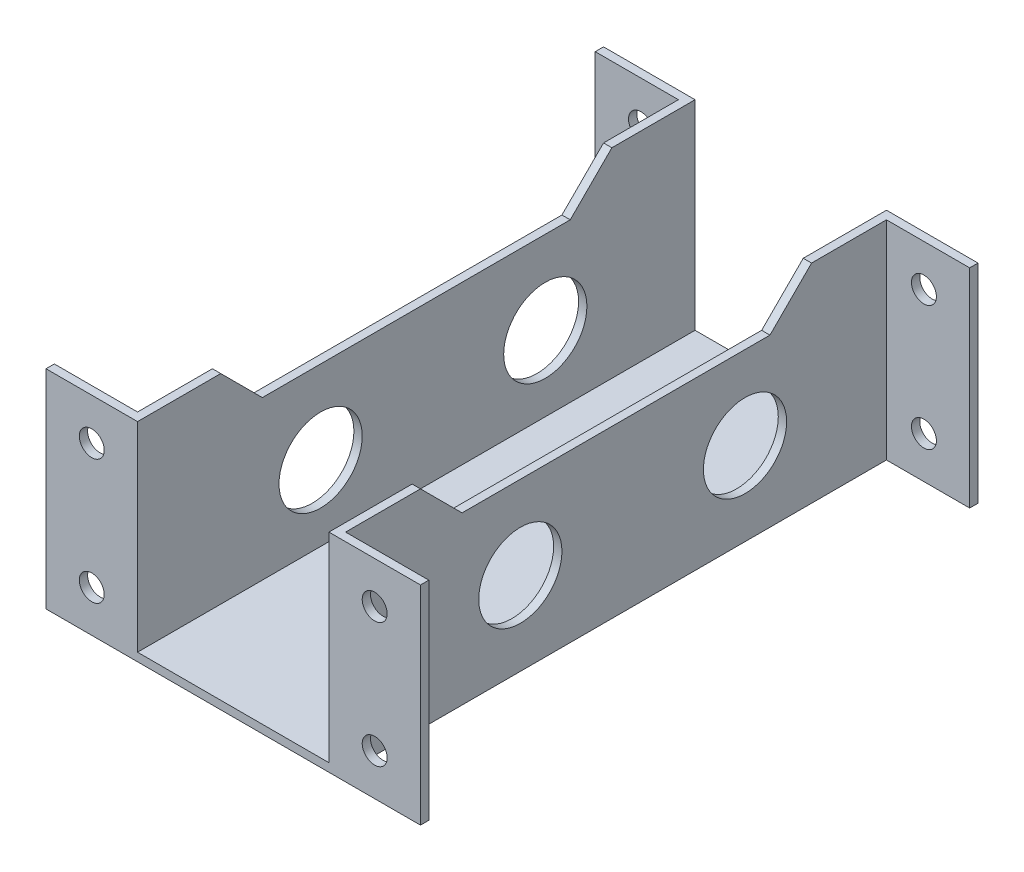
from build123d import *

# Parameters (mm, degrees)
SKETCH1_W               = 25
SKETCH1_H               = 67
BOSS_EXTRUDE1_DEPTH     = 1
SKETCH2_W               = 1
SKETCH2_H               = 67
BOSS_EXTRUDE2_DEPTH     = 24
SKETCH3_W               = 1
SKETCH3_H               = 25
BOSS_EXTRUDE3_DEPTH     = 10
SKETCH4_W               = 1
SKETCH4_H               = 25
BOSS_EXTRUDE4_DEPTH     = 10
SKETCH5_R               = 5
CUT_EXTRUDE1_DEPTH      = 47.952103254
SKETCH10_R              = 1.5
CUT_EXTRUDE3_DEPTH      = 75.968326645
CUT_EXTRUDE4_DEPTH      = 55.518345536
CUT_EXTRUDE4_DEPTH_BACK = 55.518345536
SKETCH9_R               = 5
CUT_EXTRUDE2_DEPTH      = 55.518345536


with BuildPart() as part:
    # Sketch1 → Boss-Extrude1 (new body)
    with BuildSketch(Plane(origin=(0, 0, 0), x_dir=(1, 0, 0), z_dir=(0, 1, 0))):
        Rectangle(SKETCH1_W, SKETCH1_H)
    extrude(amount=BOSS_EXTRUDE1_DEPTH)

    # Sketch2 → Boss-Extrude2 (add)
    with BuildSketch(Plane(origin=(0, 1, 0), x_dir=(1, 0, 0), z_dir=(0, 1, 0))):
        with Locations((12, 0)):
            Rectangle(SKETCH2_W, SKETCH2_H)
        with Locations((-12, 0)):
            Rectangle(SKETCH2_W, SKETCH2_H)
    extrude(amount=BOSS_EXTRUDE2_DEPTH)

    # Sketch3 → Boss-Extrude3 (add)
    with BuildSketch(Plane(origin=(12.5, 0, 0), x_dir=(0, 0, -1), z_dir=(1, 0, 0))):
        with Locations((-33, 12.5)):
            Rectangle(SKETCH3_W, SKETCH3_H)
        with Locations((33, 12.5)):
            Rectangle(SKETCH3_W, SKETCH3_H)
    extrude(amount=BOSS_EXTRUDE3_DEPTH)

    # Sketch4 → Boss-Extrude4 (add)
    with BuildSketch(Plane.ZY.offset(12.5)):
        with Locations((-33, 12.5)):
            Rectangle(SKETCH4_W, SKETCH4_H)
        with Locations((33, 12.5)):
            Rectangle(SKETCH4_W, SKETCH4_H)
    extrude(amount=BOSS_EXTRUDE4_DEPTH)

    # Sketch5 → Cut-Extrude1 (cut, through all)
    with BuildSketch(Plane(origin=(0, 1, 0), x_dir=(1, 0, 0), z_dir=(0, 1, 0))):
        with Locations(Location((0, -11.5, 0), (0, 0, 270))):
            Circle(SKETCH5_R)
        with Locations(Location((0, 15.5, 0), (0, 0, 270))):
            Circle(SKETCH5_R)
    extrude(amount=-CUT_EXTRUDE1_DEPTH, mode=Mode.SUBTRACT)

    # Sketch10 → Cut-Extrude3 (cut, through all)
    with BuildSketch(Plane.XY.offset(33.5)):
        with Locations((17, 20)):
            Circle(SKETCH10_R)
        with Locations((17, 5)):
            Circle(SKETCH10_R)
        with Locations((-17, 20)):
            Circle(SKETCH10_R)
        with Locations((-17, 5)):
            Circle(SKETCH10_R)
    extrude(amount=-CUT_EXTRUDE3_DEPTH, mode=Mode.SUBTRACT)

    # Sketch11 → Cut-Extrude4 (cut, two sides: drawn at the far end of the back side and taken through both)
    with BuildSketch(Plane(origin=(12.5, 0, 0), x_dir=(0, 0, -1), z_dir=(1, 0, 0)).offset(-CUT_EXTRUDE4_DEPTH_BACK)):
        Polygon((0, 25), (-23.5, 25), (-18.5, 20), (0, 20), align=None)
        Polygon((23.5, 25), (0, 25), (0, 20), (18.5, 20), align=None)
    extrude(amount=CUT_EXTRUDE4_DEPTH + CUT_EXTRUDE4_DEPTH_BACK, mode=Mode.SUBTRACT)

    # Sketch9 → Cut-Extrude2 (cut, through all)
    with BuildSketch(Plane(origin=(12.5, 0, 0), x_dir=(0, 0, -1), z_dir=(1, 0, 0))):
        with Locations((-11.5, 10)):
            Circle(SKETCH9_R)
        with Locations((15.5, 10)):
            Circle(SKETCH9_R)
    extrude(amount=-CUT_EXTRUDE2_DEPTH, mode=Mode.SUBTRACT)


solid = part.part
